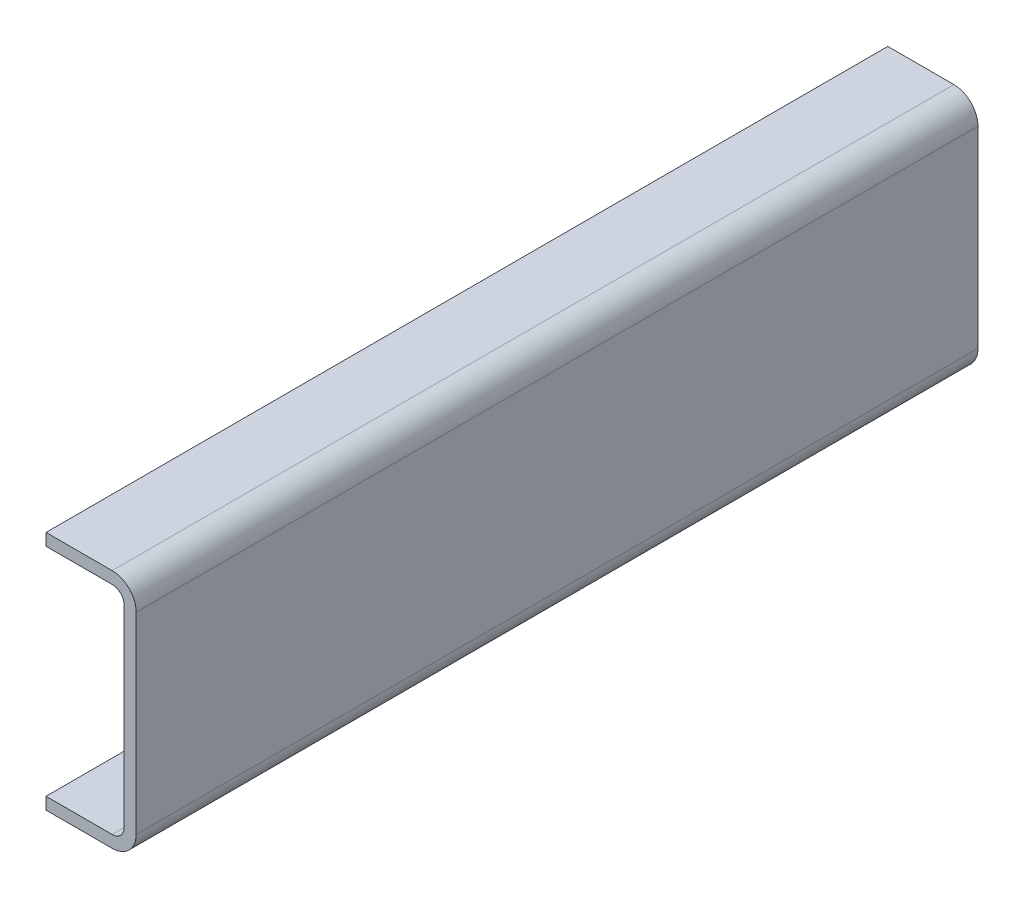
from build123d import *

# Parameters (mm, degrees)
BOSS_EXTRUDE1_DEPTH = 88.9


with BuildPart() as part:
    # Sketch1 → Boss-Extrude1 (new body)
    with BuildSketch(Plane.XY):
        with BuildLine():
            Line((0, 2.54), (0, 22.86))
            ThreePointArc((0, 22.86), (-0.743948776, 24.656051224), (-2.54, 25.4))
            Line((-2.54, 25.4), (-9.525, 25.4))
            Line((-9.525, 25.4), (-9.525, 24.13))
            Line((-9.525, 24.13), (-2.54, 24.13))
            ThreePointArc((-2.54, 24.13), (-1.641974388, 23.758025612), (-1.27, 22.86))
            Line((-1.27, 22.86), (-1.27, 2.54))
            ThreePointArc((-1.27, 2.54), (-1.641974388, 1.641974388), (-2.54, 1.27))
            Line((-2.54, 1.27), (-9.525, 1.27))
            Line((-9.525, 1.27), (-9.525, 0))
            Line((-9.525, 0), (-2.54, 0))
            ThreePointArc((-2.54, 0), (-0.743948776, 0.743948776), (0, 2.54))
        make_face()
    extrude(amount=BOSS_EXTRUDE1_DEPTH)


solid = part.part
